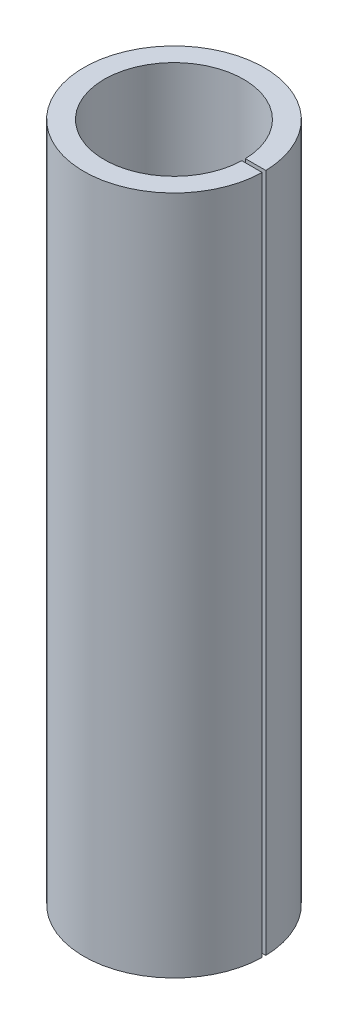
from build123d import *

# Parameters (mm, degrees)
SKETCH1_W          = 1.143
SKETCH1_H          = 38.1
SKETCH2_W          = 0.2
SKETCH2_H          = 38.1
CUT_EXTRUDE1_DEPTH = 5.3


with BuildPart() as part:
    # Sketch1 → Revolve1 (revolve)
    with BuildSketch(Plane.XY, mode=Mode.PRIVATE) as revolve1_sk:
        with Locations((4.47675, 19.05)):
            Rectangle(SKETCH1_W, SKETCH1_H)
    revolve(revolve1_sk.sketch.rotate(Axis((0, 0, 0), (0, 1, 0)), 270), axis=Axis((0, 0, 0), (0, 1, 0)))

    # Sketch2 → Cut-Extrude1 (cut)
    with BuildSketch(Plane(origin=(0, 0, 0), x_dir=(0, 0, -1), z_dir=(1, 0, 0))):
        with Locations((0, 19.05)):
            Rectangle(SKETCH2_W, SKETCH2_H)
    extrude(amount=CUT_EXTRUDE1_DEPTH, mode=Mode.SUBTRACT)


solid = part.part
